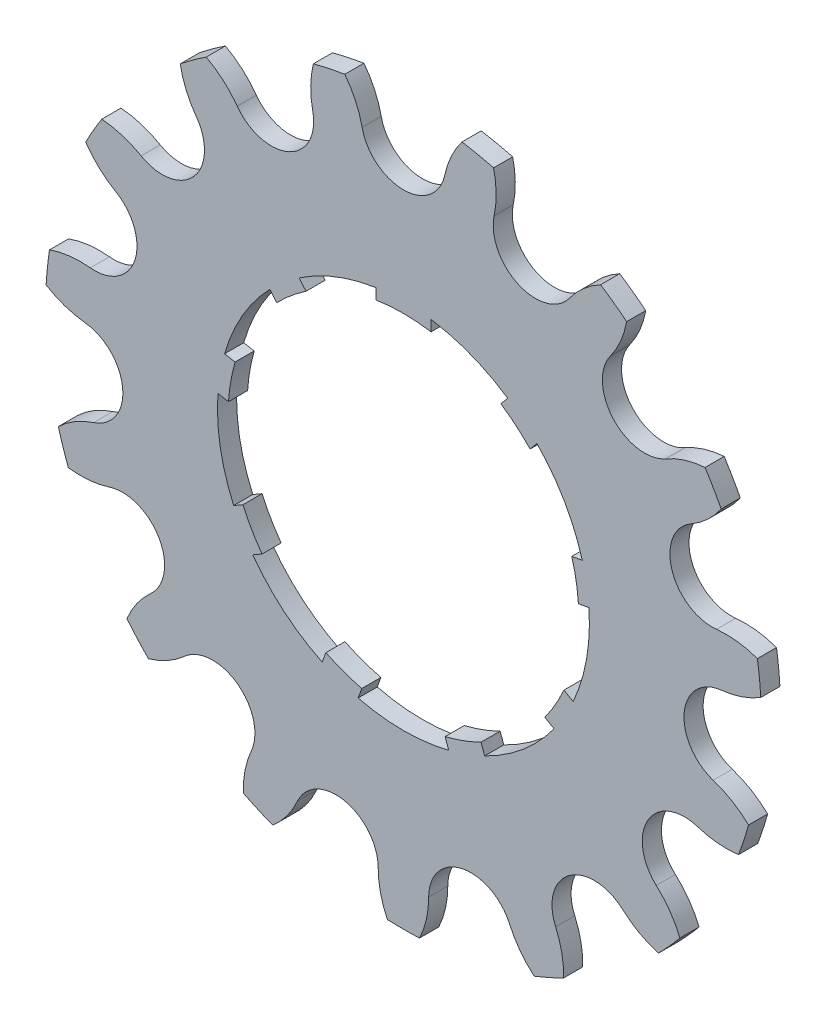
from build123d import *

# Parameters (mm, degrees)
SK_DISCO_R           = 33.684401195
DISCO_DEPTH          = 1.8
HUECO_DIENTE_DEPTH   = 48.670932105
MATRIZ_DIENTES_COUNT = 15


with BuildPart() as part:
    # Sk_Disco → Disco (new body)
    with BuildSketch(Plane.XY):
        Circle(SK_DISCO_R)
        with BuildLine():
            Line((2.6, 17.305779381), (2.6, 16.293863876))
            ThreePointArc((2.6, 16.293863876), (0, 16.5), (-2.6, 16.293863876))
            Line((-2.6, 16.293863876), (-2.6, 17.305779381))
            ThreePointArc((-2.6, 17.305779381), (-6.362648192, 16.302352836), (-9.810241185, 14.491693065))
            Line((-9.810241185, 14.491693065), (-9.163816615, 13.721314261))
            ThreePointArc((-9.163816615, 13.721314261), (-10.60599556, 12.639733311), (-11.92157661, 11.407278866))
            Line((-11.92157661, 11.407278866), (-12.56800118, 12.17765767))
            ThreePointArc((-12.56800118, 12.17765767), (-15.155444566, 8.75), (-16.830161491, 4.795379462))
            Line((-16.830161491, 4.795379462), (-15.839781591, 4.620748764))
            ThreePointArc((-15.839781591, 4.620748764), (-16.249327925, 2.865194932), (-16.464915031, 1.075440854))
            Line((-16.464915031, 1.075440854), (-17.455294931, 1.250071551))
            ThreePointArc((-17.455294931, 1.250071551), (-17.234135678, -3.038843109), (-15.975062189, -7.144745486))
            Line((-15.975062189, -7.144745486), (-15.104136721, -6.641916433))
            ThreePointArc((-15.104136721, -6.641916433), (-14.289419162, -8.25), (-13.304136721, -9.759607887))
            Line((-13.304136721, -9.759607887), (-14.175062189, -10.26243694))
            ThreePointArc((-14.175062189, -10.26243694), (-11.24878317, -13.405777755), (-7.645053746, -15.741764616))
            Line((-7.645053746, -15.741764616), (-7.301098416, -14.796755115))
            ThreePointArc((-7.301098416, -14.796755115), (-5.643332365, -15.504928243), (-3.918204981, -16.028027631))
            Line((-3.918204981, -16.028027631), (-4.262160311, -16.973037132))
            ThreePointArc((-4.262160311, -16.973037132), (0, -17.5), (4.262160311, -16.973037132))
            Line((4.262160311, -16.973037132), (3.918204981, -16.028027631))
            ThreePointArc((3.918204981, -16.028027631), (5.643332365, -15.504928243), (7.301098416, -14.796755115))
            Line((7.301098416, -14.796755115), (7.645053746, -15.741764616))
            ThreePointArc((7.645053746, -15.741764616), (11.24878317, -13.405777755), (14.175062189, -10.26243694))
            Line((14.175062189, -10.26243694), (13.304136721, -9.759607887))
            ThreePointArc((13.304136721, -9.759607887), (14.289419162, -8.25), (15.104136721, -6.641916433))
            Line((15.104136721, -6.641916433), (15.975062189, -7.144745486))
            ThreePointArc((15.975062189, -7.144745486), (17.234135678, -3.038843109), (17.455294931, 1.250071551))
            Line((17.455294931, 1.250071551), (16.464915031, 1.075440854))
            ThreePointArc((16.464915031, 1.075440854), (16.249327925, 2.865194932), (15.839781591, 4.620748764))
            Line((15.839781591, 4.620748764), (16.830161491, 4.795379462))
            ThreePointArc((16.830161491, 4.795379462), (15.155444566, 8.75), (12.56800118, 12.17765767))
            Line((12.56800118, 12.17765767), (11.92157661, 11.407278866))
            ThreePointArc((11.92157661, 11.407278866), (10.60599556, 12.639733311), (9.163816615, 13.721314261))
            Line((9.163816615, 13.721314261), (9.810241185, 14.491693065))
            ThreePointArc((9.810241185, 14.491693065), (6.362648192, 16.302352836), (2.6, 17.305779381))
        make_face(mode=Mode.SUBTRACT)
    extrude(amount=DISCO_DEPTH)

    # Sk_Hueco → Hueco_diente (cut, through all)
    with BuildSketch(Plane.XY):
        with BuildLine():
            ThreePointArc((-3.888136713, 29.715364118), (0, 26.566813089), (3.888136713, 29.715364118))
            ThreePointArc((3.888136713, 29.715364118), (5.094660737, 32.637236856), (7.26310974, 34.937425858))
            ThreePointArc((7.26310974, 34.937425858), (0, 35.684401195), (-7.26310974, 34.937425858))
            ThreePointArc((-7.26310974, 34.937425858), (-5.094660737, 32.637236856), (-3.888136713, 29.715364118))
        make_face()
    hueco_diente = extrude(amount=HUECO_DIENTE_DEPTH, mode=Mode.SUBTRACT)

    # Matriz_dientes: Hueco_diente ×15 about axis
    matriz_dientes_axis = Axis((0, 0, -0.09), (0, 0, 1))
    for i in range(1, MATRIZ_DIENTES_COUNT):
        add(hueco_diente.rotate(matriz_dientes_axis, i * 360 / MATRIZ_DIENTES_COUNT), mode=Mode.SUBTRACT)


solid = part.part
